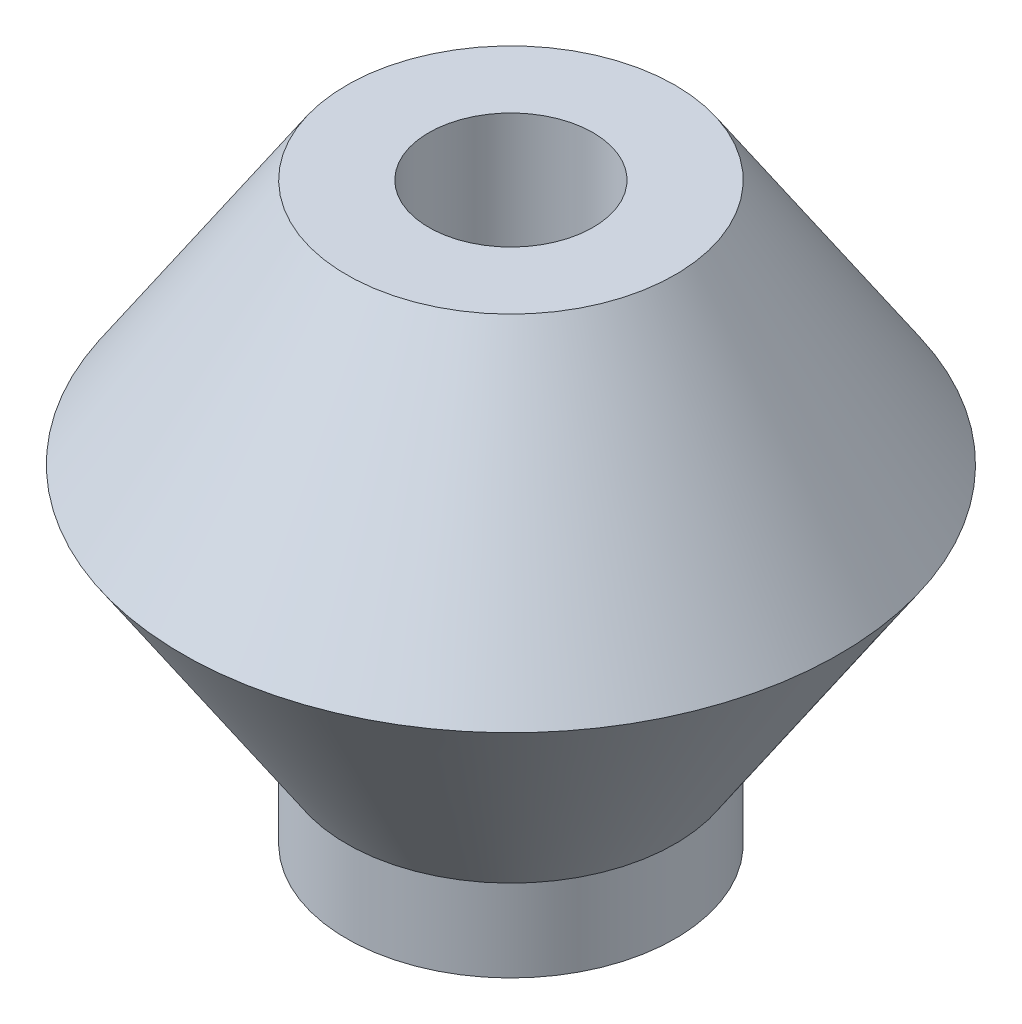
from build123d import *


with BuildPart() as part:
    # Sketch1 → Revolve1 (revolve)
    with BuildSketch(Plane.XY, mode=Mode.PRIVATE) as revolve1_sk:
        Polygon((2, 0), (2, 14), (4, 14), (8, 8), (4, 2), (4, 0), align=None)
    revolve(revolve1_sk.sketch.rotate(Axis((0, 0, 0), (0, 1, 0)), 90), axis=Axis((0, 0, 0), (0, 1, 0)))


solid = part.part
